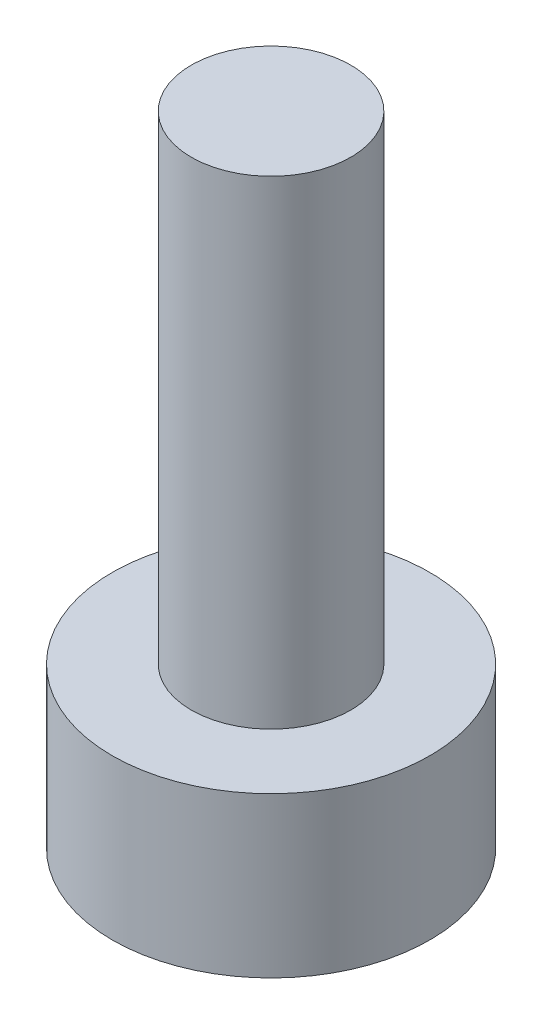
from build123d import *

# Parameters (mm, degrees)
M2X6_FULL_THREAD_ENVELOPE_SKETCH_R     = 1
M2X6_FULL_THREAD_ENVELOPE_DEPTH        = 6
PURCHASED_DIN912_MAXIMUM_HEAD_SKETCH_R = 1.99
PURCHASED_DIN912_MAXIMUM_HEAD_DEPTH    = 2


with BuildPart() as part:
    # M2x6 full-thread envelope sketch → M2x6 full-thread envelope (new body)
    with BuildSketch(Plane(origin=(0, -73, 0), x_dir=(1, 0, 0), z_dir=(0, 1, 0))):
        with Locations(Location((-26.291651246, 8.5, 0), (0, 0, 270))):
            Circle(M2X6_FULL_THREAD_ENVELOPE_SKETCH_R)
    extrude(amount=M2X6_FULL_THREAD_ENVELOPE_DEPTH)

    # Purchased DIN912 maximum head sketch → Purchased DIN912 maximum head (add)
    with BuildSketch(Plane(origin=(0, -75, 0), x_dir=(1, 0, 0), z_dir=(0, 1, 0))):
        with Locations(Location((-26.291651246, 8.5, 0), (0, 0, 270))):
            Circle(PURCHASED_DIN912_MAXIMUM_HEAD_SKETCH_R)
    extrude(amount=PURCHASED_DIN912_MAXIMUM_HEAD_DEPTH)


solid = part.part
